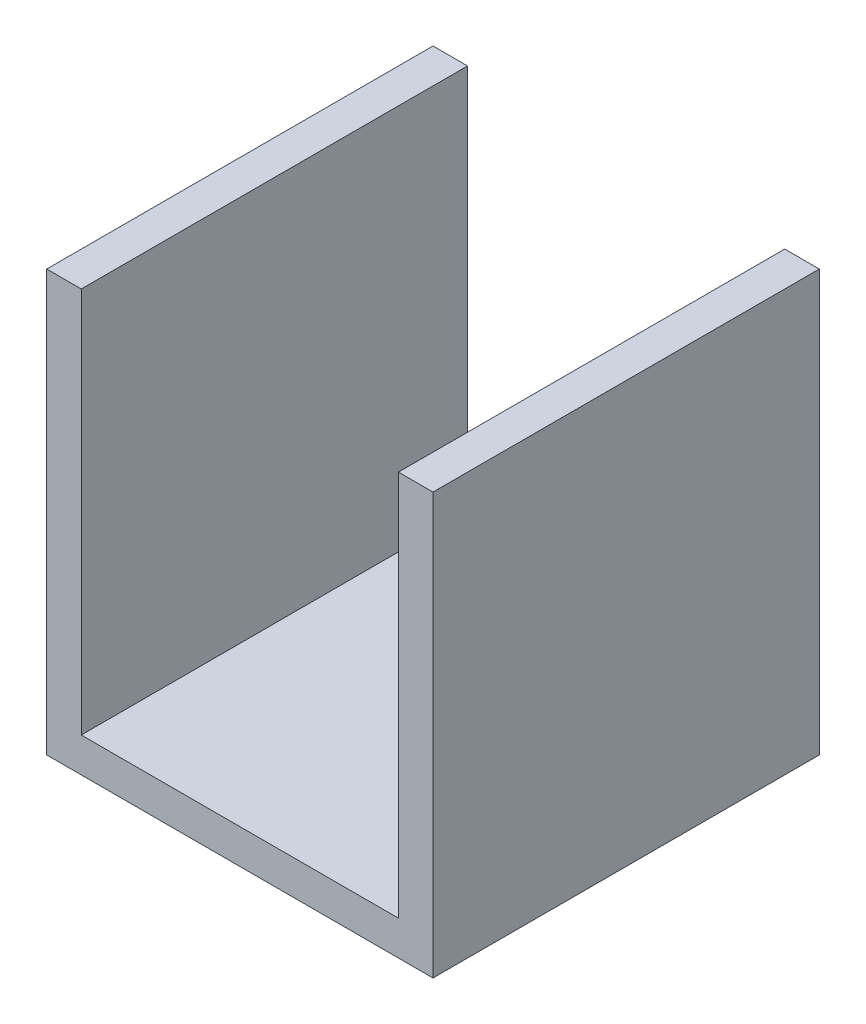
from build123d import *

# Parameters (mm, degrees)
SKETCH1_W           = 88.9
SKETCH1_H           = 88.9
BOSS_EXTRUDE1_DEPTH = 7.9502
SKETCH2_W           = 7.9502
SKETCH2_H           = 88.9
BOSS_EXTRUDE2_DEPTH = 96.8502


with BuildPart() as part:
    # Sketch1 → Boss-Extrude1 (new body)
    with BuildSketch(Plane(origin=(0, 0, 0), x_dir=(1, 0, 0), z_dir=(0, 1, 0))):
        with Locations((44.45, 44.45)):
            Rectangle(SKETCH1_W, SKETCH1_H)
    extrude(amount=BOSS_EXTRUDE1_DEPTH)

    # Sketch2 → Boss-Extrude2 (add)
    with BuildSketch(Plane(origin=(0, 0, 0), x_dir=(1, 0, 0), z_dir=(0, 1, 0))):
        with Locations((3.9751, 44.45)):
            Rectangle(SKETCH2_W, SKETCH2_H)
        with Locations((84.9249, 44.45)):
            Rectangle(SKETCH2_W, SKETCH2_H)
    extrude(amount=BOSS_EXTRUDE2_DEPTH)


solid = part.part
